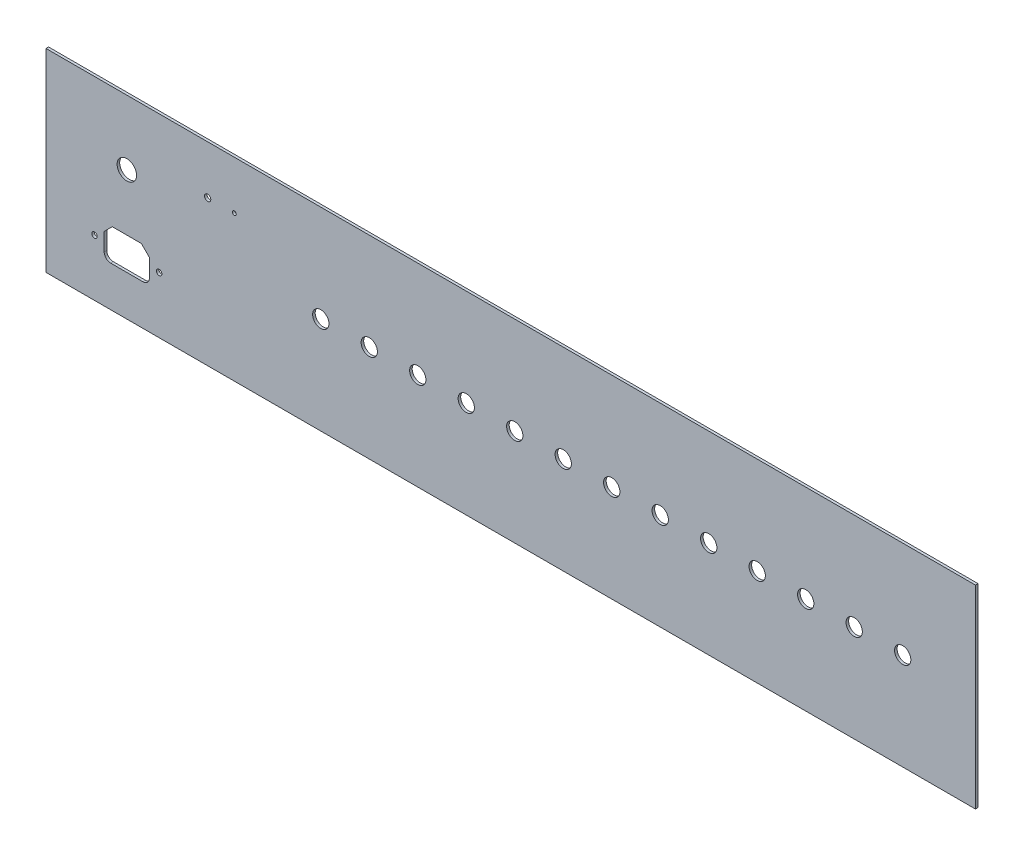
from build123d import *

# Parameters (mm, degrees)
SKETCH1_W               = 575
SKETCH1_H               = 120
BOSS_EXTRUDE1_DEPTH     = 1.5875
M3_CLEARANCE_HOLE1_D    = 3.4
F_3_8_CLEARANCE_HOLE1_D = 10.0838
LPATTERN1_COUNT         = 13
LPATTERN1_PITCH         = 30
CUT_EXTRUDE1_REACH      = 295.698
SKETCH8_R               = 1.95
SKETCH8_R_2             = 1.2
CUT_EXTRUDE2_REACH      = 295.698
SKETCH9_W               = 28
SKETCH9_H               = 20
FILLET1_R               = 4
CHAMFER1_SIZE           = 5
CUT_EXTRUDE3_REACH      = 295.698
SKETCH10_R              = 6


with BuildPart() as part:
    # Sketch1 → Boss-Extrude1 (new body)
    with BuildSketch(Plane.XY):
        Rectangle(SKETCH1_W, SKETCH1_H)
    extrude(amount=BOSS_EXTRUDE1_DEPTH)

    # M3 Clearance Hole1 (through all)
    with Locations(Plane.XY.offset(1.5875)):
        with Locations((-257.5, -25), (-217.5, -25)):
            Hole(M3_CLEARANCE_HOLE1_D / 2)

    # 3/8 Clearance Hole1 (through all)
    with Locations(Plane.XY.offset(1.5875)):
        with Locations((-117.5, 0)):
            f_3_8_clearance_hole1 = Hole(F_3_8_CLEARANCE_HOLE1_D / 2)

    # LPattern1: 3/8 Clearance Hole1 ×13
    with Locations(*[(i * LPATTERN1_PITCH, 0, 0) for i in range(1, LPATTERN1_COUNT)]):
        add(f_3_8_clearance_hole1, mode=Mode.SUBTRACT)

    # Sketch8 → Cut-Extrude1 (cut, up to next)
    with BuildSketch(Plane.XY.offset(1.5875), mode=Mode.PRIVATE) as cut_extrude1_sk1:
        with Locations((-187.5, 30)):
            Circle(SKETCH8_R)
    cut_extrude1_tool1 = extrude(cut_extrude1_sk1.sketch, amount=-CUT_EXTRUDE1_REACH, mode=Mode.PRIVATE) & part.part
    # Sketch8 → Cut-Extrude1 (cut, up to next)
    with BuildSketch(Plane.XY.offset(1.5875), mode=Mode.PRIVATE) as cut_extrude1_sk2:
        with Locations((-170.99, 30)):
            Circle(SKETCH8_R_2)
    cut_extrude1_tool2 = extrude(cut_extrude1_sk2.sketch, amount=-CUT_EXTRUDE1_REACH, mode=Mode.PRIVATE) & part.part
    add(cut_extrude1_tool1.solids().sort_by_distance((-187.5, 30, 1.5875))[0], mode=Mode.SUBTRACT)
    add(cut_extrude1_tool2.solids().sort_by_distance((-170.99, 30, 1.5875))[0], mode=Mode.SUBTRACT)

    # Sketch9 → Cut-Extrude2 (cut, up to next)
    with BuildSketch(Plane.XY.offset(1.5875), mode=Mode.PRIVATE) as cut_extrude2_sk1:
        with Locations((-237.5, -25)):
            Rectangle(SKETCH9_W, SKETCH9_H)
    cut_extrude2_tool1 = extrude(cut_extrude2_sk1.sketch, amount=-CUT_EXTRUDE2_REACH, mode=Mode.PRIVATE) & part.part
    add(cut_extrude2_tool1.solids().sort_by_distance((-237.5, -25, 1.5875))[0], mode=Mode.SUBTRACT)

    # Fillet1
    fillet1_edges = [part.edges().sort_by_distance(p)[0] for p in [
        (-251.5, -35, 0.79375),
        (-223.5, -35, 0.79375),
    ]]
    fillet(fillet1_edges, radius=FILLET1_R)

    # Chamfer1
    chamfer1_edges = [part.edges().sort_by_distance(p)[0] for p in [
        (-251.5, -15, 0.79375),
        (-223.5, -15, 0.79375),
    ]]
    chamfer(chamfer1_edges, length=CHAMFER1_SIZE)

    # Sketch10 → Cut-Extrude3 (cut, up to next)
    with BuildSketch(Plane.XY.offset(1.5875), mode=Mode.PRIVATE) as cut_extrude3_sk1:
        with Locations((-237.5, 20)):
            Circle(SKETCH10_R)
    cut_extrude3_tool1 = extrude(cut_extrude3_sk1.sketch, amount=-CUT_EXTRUDE3_REACH, mode=Mode.PRIVATE) & part.part
    add(cut_extrude3_tool1.solids().sort_by_distance((-237.5, 20, 1.5875))[0], mode=Mode.SUBTRACT)


solid = part.part
